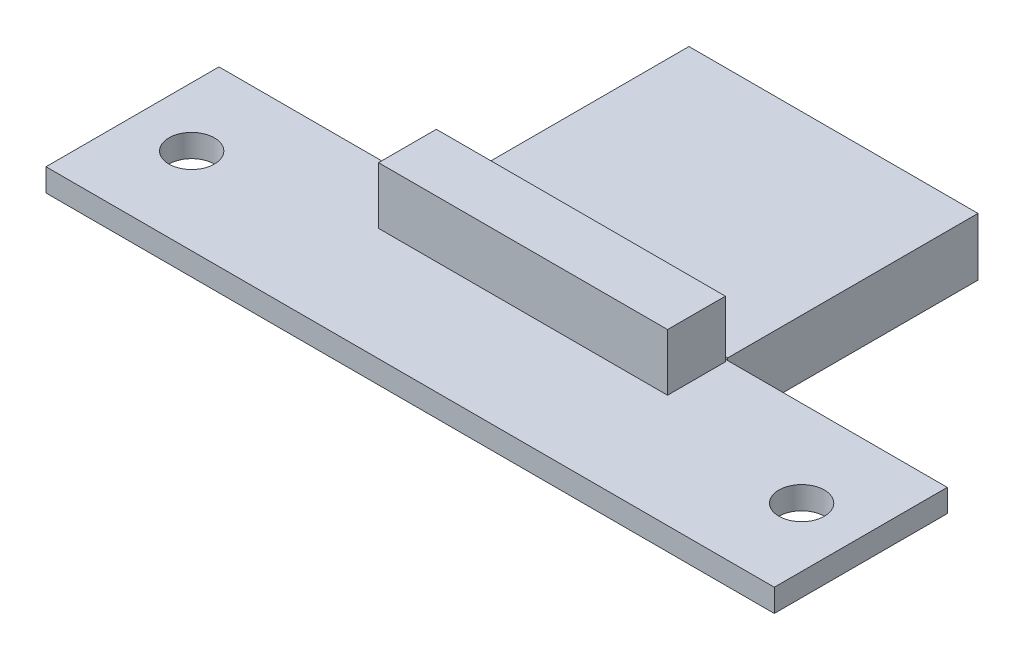
from build123d import *

# Parameters (mm, degrees)
SKETCH1_W           = 32
SKETCH1_H           = 7.6
BOSS_EXTRUDE1_DEPTH = 1
SKETCH2_R           = 1
CUT_EXTRUDE1_DEPTH  = 17.475436261
SKETCH3_W           = 1.6
SKETCH3_H           = 2.2
BOSS_EXTRUDE2_DEPTH = 1
SKETCH4_W           = 12.7
SKETCH4_H           = 2.54
BOSS_EXTRUDE3_DEPTH = 11
SKETCH5_W           = 12.7
SKETCH5_H           = 2.54
BOSS_EXTRUDE4_DEPTH = 2.5


with BuildPart() as part:
    # Sketch1 → Boss-Extrude1 (new body)
    with BuildSketch(Plane(origin=(0, 0, 0), x_dir=(1, 0, 0), z_dir=(0, 1, 0))):
        Rectangle(SKETCH1_W, SKETCH1_H)
    extrude(amount=BOSS_EXTRUDE1_DEPTH)

    # Sketch2 → Cut-Extrude1 (cut, through all)
    with BuildSketch(Plane(origin=(0, 1, 0), x_dir=(1, 0, 0), z_dir=(0, 1, 0))):
        with Locations(Location((-13.4, 0, 0), (0, 0, 270))):
            Circle(SKETCH2_R)
        with Locations(Location((13.4, 0, 0), (0, 0, 270))):
            Circle(SKETCH2_R)
    extrude(amount=-CUT_EXTRUDE1_DEPTH, mode=Mode.SUBTRACT)

    # Sketch3 → Boss-Extrude2 (add)
    with BuildSketch(Plane.XZ):
        with Locations((-9.5, 0)):
            Rectangle(SKETCH3_W, SKETCH3_H)
        with Locations((9.5, 0)):
            Rectangle(SKETCH3_W, SKETCH3_H)
        with Locations((0, 1.1)):
            Rectangle(SKETCH3_W, SKETCH3_H)
    extrude(amount=BOSS_EXTRUDE2_DEPTH)

    # Sketch4 → Boss-Extrude3 (add)
    with BuildSketch(Plane(origin=(0, 0, -3.8), x_dir=(-1, 0, 0), z_dir=(0, 0, -1))):
        with Locations((0, -0.17)):
            Rectangle(SKETCH4_W, SKETCH4_H)
    extrude(amount=BOSS_EXTRUDE3_DEPTH)

    # Sketch5 → Boss-Extrude4 (add)
    with BuildSketch(Plane(origin=(0, 1, 0), x_dir=(1, 0, 0), z_dir=(0, 1, 0))):
        with Locations((0, 2.43)):
            Rectangle(SKETCH5_W, SKETCH5_H)
    extrude(amount=BOSS_EXTRUDE4_DEPTH)


solid = part.part
